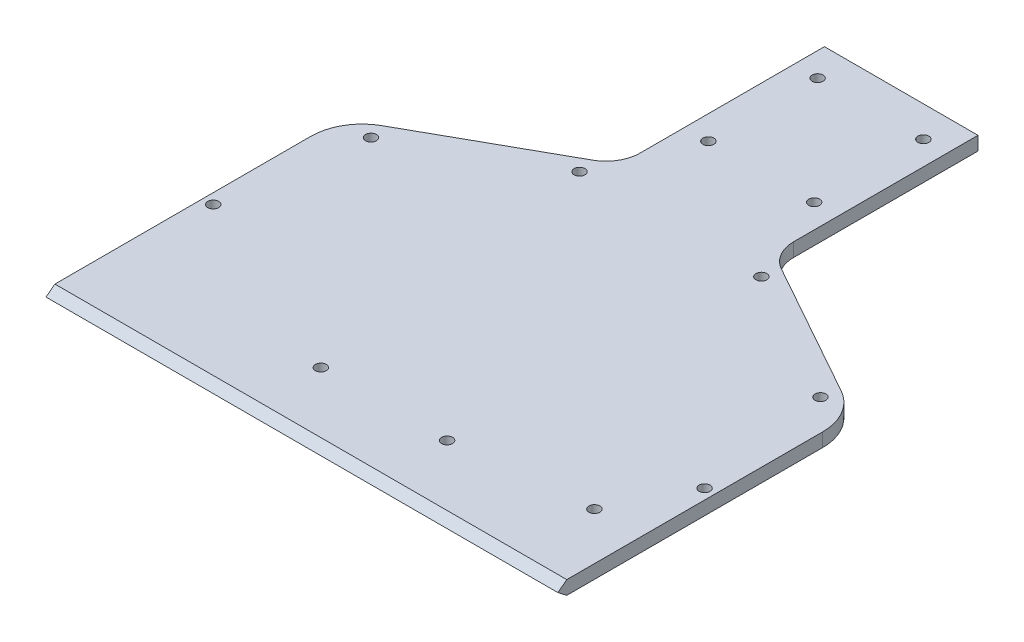
from build123d import *
from build123d.topology import SkipClean

# Parameters (mm, degrees)
BOSS_EXTRU_1_DEPTH                          = 4
FRAISAGE_POUR_VIS_T_TE_FRAIS_E_M31_AT_COUNT = 2
FRAISAGE_POUR_VIS_T_TE_FRAIS_E_M31_AT_PITCH = 37
FRAISAGE_POUR_VIS_T_TE_FRAIS_E_M31_2_COUNT  = 2
FRAISAGE_POUR_VIS_T_TE_FRAIS_E_M31_2_PITCH  = 76.249233439
FRAISAGE_POUR_VIS_T_TE_FRAIS_E_M31_3_COUNT  = 2
FRAISAGE_POUR_VIS_T_TE_FRAIS_E_M31_3_PITCH  = 84.163802195
FRAISAGE_POUR_VIS_T_TE_FRAIS_E_M31_4_COUNT  = 2
FRAISAGE_POUR_VIS_T_TE_FRAIS_E_M31_4_PITCH  = 48.918299235
FRAISAGE_POUR_VIS_T_TE_FRAIS_E_M31_5_COUNT  = 2
FRAISAGE_POUR_VIS_T_TE_FRAIS_E_M31_5_PITCH  = 32
FRAISAGE_POUR_VIS_T_TE_FRAIS_E_M31_6_COUNT  = 2
FRAISAGE_POUR_VIS_T_TE_FRAIS_E_M31_6_PITCH  = 146.221444734
FRAISAGE_POUR_VIS_T_TE_FRAIS_E_M31_7_COUNT  = 2
FRAISAGE_POUR_VIS_T_TE_FRAIS_E_M31_7_PITCH  = 149.336569199
FRAISAGE_POUR_VIS_T_TE_FRAIS_E_M31_8_COUNT  = 2
FRAISAGE_POUR_VIS_T_TE_FRAIS_E_M31_8_PITCH  = 178.221185329
FRAISAGE_POUR_VIS_T_TE_FRAIS_E_M31_9_COUNT  = 2
FRAISAGE_POUR_VIS_T_TE_FRAIS_E_M31_9_PITCH  = 180.785759671
FRAISAGE_POUR_VIS_T_TE_FRAIS_E_M31_10_COUNT = 2
FRAISAGE_POUR_VIS_T_TE_FRAIS_E_M31_10_PITCH = 93.722010844
FRAISAGE_POUR_VIS_T_TE_FRAIS_E_M31_11_COUNT = 2
FRAISAGE_POUR_VIS_T_TE_FRAIS_E_M31_11_PITCH = 71.254220114
FRAISAGE_POUR_VIS_T_TE_FRAIS_E_M31_12_COUNT = 2
FRAISAGE_POUR_VIS_T_TE_FRAIS_E_M31_12_PITCH = 81.138523202
FRAISAGE_POUR_VIS_T_TE_FRAIS_E_M31_13_COUNT = 2
FRAISAGE_POUR_VIS_T_TE_FRAIS_E_M31_13_PITCH = 110.207887466
FRAISAGE_POUR_VIS_T_TE_FRAIS_E_M31_14_COUNT = 2
FRAISAGE_POUR_VIS_T_TE_FRAIS_E_M31_14_PITCH = 120.180990857
FRAISAGE_POUR_VIS_T_TE_FRAIS_E_M31_15_COUNT = 2
FRAISAGE_POUR_VIS_T_TE_FRAIS_E_M31_15_PITCH = 126.594083229
FRAISAGE_POUR_VIS_T_TE_FRAIS_E_M31_16_COUNT = 2
FRAISAGE_POUR_VIS_T_TE_FRAIS_E_M31_16_PITCH = 126.717880504
FRAISAGE_POUR_VIS_T_TE_FRAIS_E_M31_17_COUNT = 2
FRAISAGE_POUR_VIS_T_TE_FRAIS_E_M31_17_PITCH = 104.212570966
FRAISAGE_POUR_VIS_T_TE_FRAIS_E_M31_18_COUNT = 2
FRAISAGE_POUR_VIS_T_TE_FRAIS_E_M31_18_PITCH = 111.926492077
FRAISAGE_POUR_VIS_T_TE_FRAIS_E_M31_19_COUNT = 2
FRAISAGE_POUR_VIS_T_TE_FRAIS_E_M31_19_PITCH = 96.715892614
FRAISAGE_POUR_VIS_T_TE_FRAIS_E_M31_20_COUNT = 2
FRAISAGE_POUR_VIS_T_TE_FRAIS_E_M31_20_PITCH = 72.361814356
FRAISAGE_POUR_VIS_T_TE_FRAIS_E_M31_21_COUNT = 2
FRAISAGE_POUR_VIS_T_TE_FRAIS_E_M31_21_PITCH = 80.151308017
FRAISAGE_POUR_VIS_T_TE_FRAIS_E_M31_22_COUNT = 2
FRAISAGE_POUR_VIS_T_TE_FRAIS_E_M31_22_PITCH = 87.174955693
FRAISAGE_POUR_VIS_T_TE_FRAIS_E_M31_23_COUNT = 2
FRAISAGE_POUR_VIS_T_TE_FRAIS_E_M31_23_PITCH = 57.642630925
FRAISAGE_POUR_VIS_T_TE_FRAIS_E_M31_24_COUNT = 2
FRAISAGE_POUR_VIS_T_TE_FRAIS_E_M31_24_PITCH = 91.32999562
FRAISAGE_POUR_VIS_T_TE_FRAIS_E_M31_25_COUNT = 2
FRAISAGE_POUR_VIS_T_TE_FRAIS_E_M31_25_PITCH = 70.407159437
ENL_V_MAT_EXTRU_1_REACH                     = 195.197
ESQUISSE7_W                                 = 176.3
ESQUISSE7_H                                 = 4
ENL_V_MAT_EXTRU_1_DIRECTION_2_REACH         = 195.197
BOSS_EXTRU_2_DEPTH                          = 150


with BuildPart() as part:
    # Esquisse1 → Boss.-Extru.1 (new body)
    with BuildSketch(Plane.XZ):
        with BuildLine():
            Line((22.5, 171.3), (22.5, 117.3))
            ThreePointArc((22.5, 117.3), (24.261102018, 111.632499665), (28.924112009, 107.961208586))
            Line((28.924112009, 107.961208586), (65.363831986, 94.008187121))
            ThreePointArc((65.363831986, 94.008187121), (72.358346973, 88.501250502), (75, 80))
            Line((75, 80), (75, -80))
            ThreePointArc((75, -80), (72.937073199, -87.591583303), (67.31571506, -93.095049185))
            Line((67.31571506, -93.095049185), (27.622856627, -115.26996721))
            ThreePointArc((27.622856627, -115.26996721), (23.875284534, -118.938944464), (22.5, -124))
            Line((22.5, -124), (22.5, -178))
            Line((22.5, -178), (-22.5, -178))
            Line((-22.5, -178), (-22.5, -124))
            ThreePointArc((-22.5, -124), (-23.875284534, -118.938944464), (-27.622856627, -115.26996721))
            Line((-27.622856627, -115.26996721), (-67.31571506, -93.095049185))
            ThreePointArc((-67.31571506, -93.095049185), (-72.937073199, -87.591583303), (-75, -80))
            Line((-75, -80), (-75, 80))
            ThreePointArc((-75, 80), (-72.358346973, 88.501250502), (-65.363831986, 94.008187121))
            Line((-65.363831986, 94.008187121), (-28.924112009, 107.961208586))
            ThreePointArc((-28.924112009, 107.961208586), (-24.261102018, 111.632499665), (-22.5, 117.3))
            Line((-22.5, 117.3), (-22.5, 171.3))
            Line((-22.5, 171.3), (22.5, 171.3))
        make_face()
    extrude(amount=BOSS_EXTRU_1_DEPTH)

    # Esquisse2 → Fraisage pour vis à tête fraisée M31 (revolve, cut)
    with BuildSketch(Plane(origin=(-14.85, -4, 9.22), x_dir=(0, 0, -1), z_dir=(1, 0, 0))):
        Polygon((0, 0), (0, 4), (1.6, 4), (1.6, 1.7), (2.9, 0.4), (2.9, 0), align=None)
    fraisage_pour_vis_t_te_frais_e_m31 = revolve(axis=Axis((-14.85, -10.35, 9.22), (0, 1, 0)), mode=Mode.SUBTRACT)

    # Fraisage pour vis à tête fraisée M31 at: Fraisage pour vis à tête fraisée M31 ×2
    with Locations(*[(i * FRAISAGE_POUR_VIS_T_TE_FRAIS_E_M31_AT_PITCH, 0, 0) for i in range(1, FRAISAGE_POUR_VIS_T_TE_FRAIS_E_M31_AT_COUNT)]):
        add(fraisage_pour_vis_t_te_frais_e_m31, mode=Mode.SUBTRACT)

    # Fraisage pour vis _ t_te frais_e M31 2: Fraisage pour vis à tête fraisée M31 ×2
    with Locations(*[Vector(0.9967313318766692, 0, -0.08078769742579317) * (i * FRAISAGE_POUR_VIS_T_TE_FRAIS_E_M31_2_PITCH) for i in range(1, FRAISAGE_POUR_VIS_T_TE_FRAIS_E_M31_2_COUNT)]):
        add(fraisage_pour_vis_t_te_frais_e_m31, mode=Mode.SUBTRACT)

    # Fraisage pour vis _ t_te frais_e M31 3: Fraisage pour vis à tête fraisée M31 ×2
    with Locations(*[Vector(0.903001029153611, 0, -0.429638384397297) * (i * FRAISAGE_POUR_VIS_T_TE_FRAIS_E_M31_3_PITCH) for i in range(1, FRAISAGE_POUR_VIS_T_TE_FRAIS_E_M31_3_COUNT)]):
        add(fraisage_pour_vis_t_te_frais_e_m31, mode=Mode.SUBTRACT)

    # Fraisage pour vis _ t_te frais_e M31 4: Fraisage pour vis à tête fraisée M31 ×2
    with Locations(*[Vector(0.7563631724521444, 0, -0.6541519329315842) * (i * FRAISAGE_POUR_VIS_T_TE_FRAIS_E_M31_4_PITCH) for i in range(1, FRAISAGE_POUR_VIS_T_TE_FRAIS_E_M31_4_COUNT)]):
        add(fraisage_pour_vis_t_te_frais_e_m31, mode=Mode.SUBTRACT)

    # Fraisage pour vis _ t_te frais_e M31 5: Fraisage pour vis à tête fraisée M31 ×2
    with Locations(*[(0, 0, -i * FRAISAGE_POUR_VIS_T_TE_FRAIS_E_M31_5_PITCH) for i in range(1, FRAISAGE_POUR_VIS_T_TE_FRAIS_E_M31_5_COUNT)]):
        add(fraisage_pour_vis_t_te_frais_e_m31, mode=Mode.SUBTRACT)

    # Fraisage pour vis _ t_te frais_e M31 6: Fraisage pour vis à tête fraisée M31 ×2
    with Locations(*[Vector(-0.004445312390285126, 0, -0.9999901195500648) * (i * FRAISAGE_POUR_VIS_T_TE_FRAIS_E_M31_6_PITCH) for i in range(1, FRAISAGE_POUR_VIS_T_TE_FRAIS_E_M31_6_COUNT)]):
        add(fraisage_pour_vis_t_te_frais_e_m31, mode=Mode.SUBTRACT)

    # Fraisage pour vis _ t_te frais_e M31 7: Fraisage pour vis à tête fraisée M31 ×2
    with Locations(*[Vector(0.2032322033569929, 0, -0.9791305691881251) * (i * FRAISAGE_POUR_VIS_T_TE_FRAIS_E_M31_7_PITCH) for i in range(1, FRAISAGE_POUR_VIS_T_TE_FRAIS_E_M31_7_COUNT)]):
        add(fraisage_pour_vis_t_te_frais_e_m31, mode=Mode.SUBTRACT)

    # Fraisage pour vis _ t_te frais_e M31 8: Fraisage pour vis à tête fraisée M31 ×2
    with Locations(*[Vector(-0.003647153388643399, 0, -0.9999933491139628) * (i * FRAISAGE_POUR_VIS_T_TE_FRAIS_E_M31_8_PITCH) for i in range(1, FRAISAGE_POUR_VIS_T_TE_FRAIS_E_M31_8_COUNT)]):
        add(fraisage_pour_vis_t_te_frais_e_m31, mode=Mode.SUBTRACT)

    # Fraisage pour vis _ t_te frais_e M31 9: Fraisage pour vis à tête fraisée M31 ×2
    with Locations(*[Vector(0.16787826682338555, 0, -0.9858077335507042) * (i * FRAISAGE_POUR_VIS_T_TE_FRAIS_E_M31_9_PITCH) for i in range(1, FRAISAGE_POUR_VIS_T_TE_FRAIS_E_M31_9_COUNT)]):
        add(fraisage_pour_vis_t_te_frais_e_m31, mode=Mode.SUBTRACT)

    # Fraisage pour vis _ t_te frais_e M31 10: Fraisage pour vis à tête fraisée M31 ×2
    with Locations(*[Vector(-0.5140271894002647, 0, 0.8577738912774534) * (i * FRAISAGE_POUR_VIS_T_TE_FRAIS_E_M31_10_PITCH) for i in range(1, FRAISAGE_POUR_VIS_T_TE_FRAIS_E_M31_10_COUNT)]):
        add(fraisage_pour_vis_t_te_frais_e_m31, mode=Mode.SUBTRACT)

    # Fraisage pour vis _ t_te frais_e M31 11: Fraisage pour vis à tête fraisée M31 ×2
    with Locations(*[Vector(-0.8020577575406399, 0, 0.5972464763972075) * (i * FRAISAGE_POUR_VIS_T_TE_FRAIS_E_M31_11_PITCH) for i in range(1, FRAISAGE_POUR_VIS_T_TE_FRAIS_E_M31_11_COUNT)]):
        add(fraisage_pour_vis_t_te_frais_e_m31, mode=Mode.SUBTRACT)

    # Fraisage pour vis _ t_te frais_e M31 12: Fraisage pour vis à tête fraisée M31 ×2
    with Locations(*[Vector(-0.7043510005461847, 0, -0.7098518634402452) * (i * FRAISAGE_POUR_VIS_T_TE_FRAIS_E_M31_12_PITCH) for i in range(1, FRAISAGE_POUR_VIS_T_TE_FRAIS_E_M31_12_COUNT)]):
        add(fraisage_pour_vis_t_te_frais_e_m31, mode=Mode.SUBTRACT)

    # Fraisage pour vis _ t_te frais_e M31 13: Fraisage pour vis à tête fraisée M31 ×2
    with Locations(*[Vector(-0.4627851347160459, 0, -0.8864704840466214) * (i * FRAISAGE_POUR_VIS_T_TE_FRAIS_E_M31_13_PITCH) for i in range(1, FRAISAGE_POUR_VIS_T_TE_FRAIS_E_M31_13_COUNT)]):
        add(fraisage_pour_vis_t_te_frais_e_m31, mode=Mode.SUBTRACT)

    # Fraisage pour vis _ t_te frais_e M31 14: Fraisage pour vis à tête fraisée M31 ×2
    with Locations(*[Vector(-0.09812659935351496, 0, -0.9951739398212329) * (i * FRAISAGE_POUR_VIS_T_TE_FRAIS_E_M31_14_PITCH) for i in range(1, FRAISAGE_POUR_VIS_T_TE_FRAIS_E_M31_14_COUNT)]):
        add(fraisage_pour_vis_t_te_frais_e_m31, mode=Mode.SUBTRACT)

    # Fraisage pour vis _ t_te frais_e M31 15: Fraisage pour vis à tête fraisée M31 ×2
    with Locations(*[Vector(0.32776375389231355, 0, -0.9447597163482464) * (i * FRAISAGE_POUR_VIS_T_TE_FRAIS_E_M31_15_PITCH) for i in range(1, FRAISAGE_POUR_VIS_T_TE_FRAIS_E_M31_15_COUNT)]):
        add(fraisage_pour_vis_t_te_frais_e_m31, mode=Mode.SUBTRACT)

    # Fraisage pour vis _ t_te frais_e M31 16: Fraisage pour vis à tête fraisée M31 ×2
    with Locations(*[Vector(0.6368680704479339, 0, -0.770972801623978) * (i * FRAISAGE_POUR_VIS_T_TE_FRAIS_E_M31_16_PITCH) for i in range(1, FRAISAGE_POUR_VIS_T_TE_FRAIS_E_M31_16_COUNT)]):
        add(fraisage_pour_vis_t_te_frais_e_m31, mode=Mode.SUBTRACT)

    # Fraisage pour vis _ t_te frais_e M31 17: Fraisage pour vis à tête fraisée M31 ×2
    with Locations(*[Vector(0.8333927394254491, 0, -0.5526812298902014) * (i * FRAISAGE_POUR_VIS_T_TE_FRAIS_E_M31_17_PITCH) for i in range(1, FRAISAGE_POUR_VIS_T_TE_FRAIS_E_M31_17_COUNT)]):
        add(fraisage_pour_vis_t_te_frais_e_m31, mode=Mode.SUBTRACT)

    # Fraisage pour vis _ t_te frais_e M31 18: Fraisage pour vis à tête fraisée M31 ×2
    with Locations(*[Vector(0.6957750607010041, 0, 0.7182597475193178) * (i * FRAISAGE_POUR_VIS_T_TE_FRAIS_E_M31_18_PITCH) for i in range(1, FRAISAGE_POUR_VIS_T_TE_FRAIS_E_M31_18_COUNT)]):
        add(fraisage_pour_vis_t_te_frais_e_m31, mode=Mode.SUBTRACT)

    # Fraisage pour vis _ t_te frais_e M31 19: Fraisage pour vis à tête fraisée M31 ×2
    with Locations(*[Vector(0.8979909883776221, 0, 0.4400138461373474) * (i * FRAISAGE_POUR_VIS_T_TE_FRAIS_E_M31_19_PITCH) for i in range(1, FRAISAGE_POUR_VIS_T_TE_FRAIS_E_M31_19_COUNT)]):
        add(fraisage_pour_vis_t_te_frais_e_m31, mode=Mode.SUBTRACT)

    # Fraisage pour vis _ t_te frais_e M31 20: Fraisage pour vis à tête fraisée M31 ×2
    with Locations(*[Vector(-0.07117013366549435, 0, 0.9974641908730537) * (i * FRAISAGE_POUR_VIS_T_TE_FRAIS_E_M31_20_PITCH) for i in range(1, FRAISAGE_POUR_VIS_T_TE_FRAIS_E_M31_20_COUNT)]):
        add(fraisage_pour_vis_t_te_frais_e_m31, mode=Mode.SUBTRACT)

    # Fraisage pour vis _ t_te frais_e M31 21: Fraisage pour vis à tête fraisée M31 ×2
    with Locations(*[Vector(0.43480263593981594, 0, 0.9005257729680967) * (i * FRAISAGE_POUR_VIS_T_TE_FRAIS_E_M31_21_PITCH) for i in range(1, FRAISAGE_POUR_VIS_T_TE_FRAIS_E_M31_21_COUNT)]):
        add(fraisage_pour_vis_t_te_frais_e_m31, mode=Mode.SUBTRACT)

    # Fraisage pour vis _ t_te frais_e M31 22: Fraisage pour vis à tête fraisée M31 ×2
    with Locations(*[Vector(0.9962723732982764, 0, -0.08626330739439464) * (i * FRAISAGE_POUR_VIS_T_TE_FRAIS_E_M31_22_PITCH) for i in range(1, FRAISAGE_POUR_VIS_T_TE_FRAIS_E_M31_22_COUNT)]):
        add(fraisage_pour_vis_t_te_frais_e_m31, mode=Mode.SUBTRACT)

    # Fraisage pour vis _ t_te frais_e M31 23: Fraisage pour vis à tête fraisée M31 ×2
    with Locations(*[Vector(-0.9914537050534457, 0, -0.1304590002100094) * (i * FRAISAGE_POUR_VIS_T_TE_FRAIS_E_M31_23_PITCH) for i in range(1, FRAISAGE_POUR_VIS_T_TE_FRAIS_E_M31_23_COUNT)]):
        add(fraisage_pour_vis_t_te_frais_e_m31, mode=Mode.SUBTRACT)

    # Fraisage pour vis _ t_te frais_e M31 24: Fraisage pour vis à tête fraisée M31 ×2
    with Locations(*[Vector(0.7648089713089968, 0, 0.6442571205700983) * (i * FRAISAGE_POUR_VIS_T_TE_FRAIS_E_M31_24_PITCH) for i in range(1, FRAISAGE_POUR_VIS_T_TE_FRAIS_E_M31_24_COUNT)]):
        add(fraisage_pour_vis_t_te_frais_e_m31, mode=Mode.SUBTRACT)

    # Fraisage pour vis _ t_te frais_e M31 25: Fraisage pour vis à tête fraisée M31 ×2
    with Locations(*[Vector(0.9920866082150472, 0, 0.12555541326586997) * (i * FRAISAGE_POUR_VIS_T_TE_FRAIS_E_M31_25_PITCH) for i in range(1, FRAISAGE_POUR_VIS_T_TE_FRAIS_E_M31_25_COUNT)]):
        add(fraisage_pour_vis_t_te_frais_e_m31, mode=Mode.SUBTRACT)

    # Esquisse4 → Enlèvement de matière-Révolution1 (revolve, cut)
    with BuildSketch(Plane(origin=(15.5, 0, 0), x_dir=(0, 0, -1), z_dir=(1, 0, 0)), mode=Mode.PRIVATE) as enl_vement_de_mati_re_r_volution1_sk:
        Polygon((-130.442327245, 1.971907347), (-128.851092213, 1.804661806), (-129.269206066, -2.173425776), (-128.112214604, -3.602191242), (-128.217747018, -4.606265087), (-131.101860514, -4.303132543), align=None)
    enl_vement_de_mati_re_r_volution1 = revolve(enl_vement_de_mati_re_r_volution1_sk.sketch.rotate(Axis((15.5, 1.971907347, 130.442327245), (0, -0.9945218953682737, 0.10452846326764959)), 180), axis=Axis((15.5, 1.971907347, 130.442327245), (0, -0.9945218953682737, 0.10452846326764959)), mode=Mode.SUBTRACT)

    # Esquisse5 → Enlèvement de matière-Révolution2 (revolve, cut)
    with SkipClean():  # the faces are left unmerged after this step: merging them gives an invalid solid
        with BuildSketch(Plane(origin=(15.5, 0, 0), x_dir=(0, 0, -1), z_dir=(1, 0, 0)), mode=Mode.PRIVATE) as enl_vement_de_mati_re_r_volution2_sk:
            Polygon((-162.75554286, 0.668908774), (-161.164307827, 0.501663233), (-161.445258889, -2.171407565), (-160.284898614, -3.602571258), (-160.3301799, -4), (-160.399257711, -4.606288173), (-163.278185176, -4.303700703), align=None)
        enl_vement_de_mati_re_r_volution2 = revolve(enl_vement_de_mati_re_r_volution2_sk.sketch.rotate(Axis((15.5, 0.668908774, 162.75554286), (0, -0.9945218953682743, 0.10452846326764464)), 180), axis=Axis((15.5, 0.668908774, 162.75554286), (0, -0.9945218953682743, 0.10452846326764464)), mode=Mode.SUBTRACT)

    # Symétrie1: Enlèvement de matière-Révolution1, Enlèvement de matière-Révolution2 across plane
    with SkipClean():  # the faces are left unmerged after this step: merging them gives an invalid solid
        add(enl_vement_de_mati_re_r_volution1.mirror(Plane(origin=(0, 0, 0), x_dir=(0, 0, 1), z_dir=(1, 0, 0))), mode=Mode.SUBTRACT)
        add(enl_vement_de_mati_re_r_volution2.mirror(Plane(origin=(0, 0, 0), x_dir=(0, 0, 1), z_dir=(1, 0, 0))), mode=Mode.SUBTRACT)

    # Esquisse7 → Enlèv. mat.-Extru.1 (cut, up to next)
    with BuildSketch(Plane(origin=(0, 0, 0), x_dir=(0, 0, -1), z_dir=(1, 0, 0)), mode=Mode.PRIVATE) as enl_v_mat_extru_1_sk1:
        with Locations((-83.15, -2)):
            Rectangle(ESQUISSE7_W, ESQUISSE7_H)
    enl_v_mat_extru_1_tool1 = extrude(enl_v_mat_extru_1_sk1.sketch, amount=-ENL_V_MAT_EXTRU_1_REACH, mode=Mode.PRIVATE) & part.part
    add(enl_v_mat_extru_1_tool1.solids().sort_by_distance((0, -2, 83.15))[0], mode=Mode.SUBTRACT)

    # Esquisse7 → Enlèv. mat.-Extru.1 direction 2 (cut, up to next)
    with BuildSketch(Plane(origin=(0, 0, 0), x_dir=(0, 0, -1), z_dir=(1, 0, 0)), mode=Mode.PRIVATE) as enl_v_mat_extru_1_direction_2_sk1:
        with Locations((-83.15, -2)):
            Rectangle(ESQUISSE7_W, ESQUISSE7_H)
    enl_v_mat_extru_1_direction_2_tool1 = extrude(enl_v_mat_extru_1_direction_2_sk1.sketch, amount=ENL_V_MAT_EXTRU_1_DIRECTION_2_REACH, mode=Mode.PRIVATE) & part.part
    add(enl_v_mat_extru_1_direction_2_tool1.solids().sort_by_distance((0, -2, 83.15))[0], mode=Mode.SUBTRACT)

    # Esquisse8 → Boss.-Extru.2 (add)
    with BuildSketch(Plane(origin=(75, 0, 0), x_dir=(0, 0, -1), z_dir=(1, 0, 0))):
        Polygon((5, 0), (2.393549254, -2), (5, -4), align=None)
    extrude(amount=-BOSS_EXTRU_2_DEPTH)


solid = part.part
